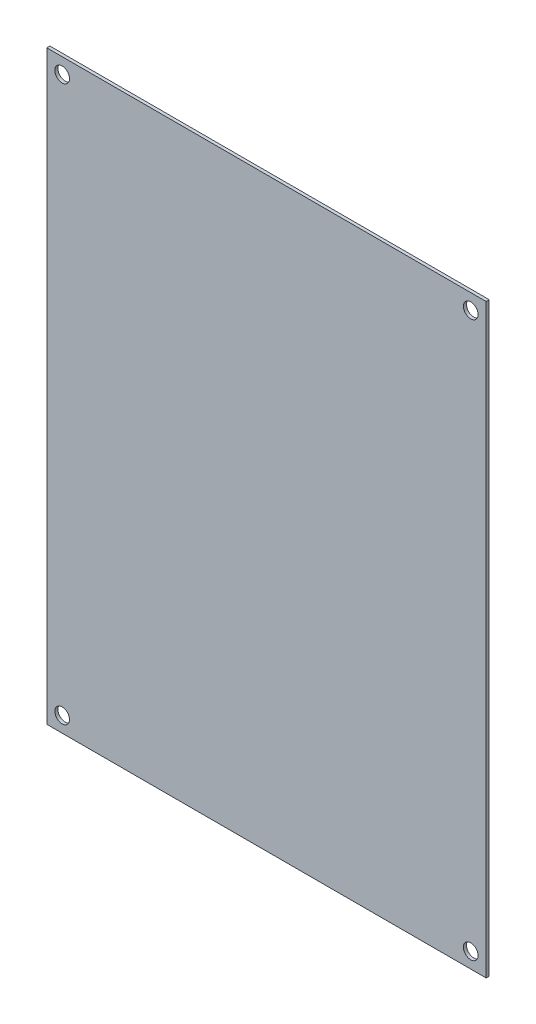
from build123d import *

# Parameters (mm, degrees)
CROQUIS1_W              = 285
CROQUIS1_H              = 380
SALIENTE_EXTRUIR1_DEPTH = 2
CROQUIS2_R              = 4.7625
CORTAR_EXTRUIR1_DEPTH   = 10


with BuildPart() as part:
    # Croquis1 → Saliente-Extruir1 (new body)
    with BuildSketch(Plane.XY):
        with Locations((62.5, 218)):
            Rectangle(CROQUIS1_W, CROQUIS1_H)
    extrude(amount=SALIENTE_EXTRUIR1_DEPTH)

    # Croquis2 → Cortar-Extruir1 (cut)
    with BuildSketch(Plane.XY.offset(2)):
        with Locations((-70, 398)):
            Circle(CROQUIS2_R)
        with Locations((195, 398)):
            Circle(CROQUIS2_R)
        with Locations((195, 38)):
            Circle(CROQUIS2_R)
        with Locations((-70, 38)):
            Circle(CROQUIS2_R)
    extrude(amount=-CORTAR_EXTRUIR1_DEPTH, mode=Mode.SUBTRACT)


solid = part.part
